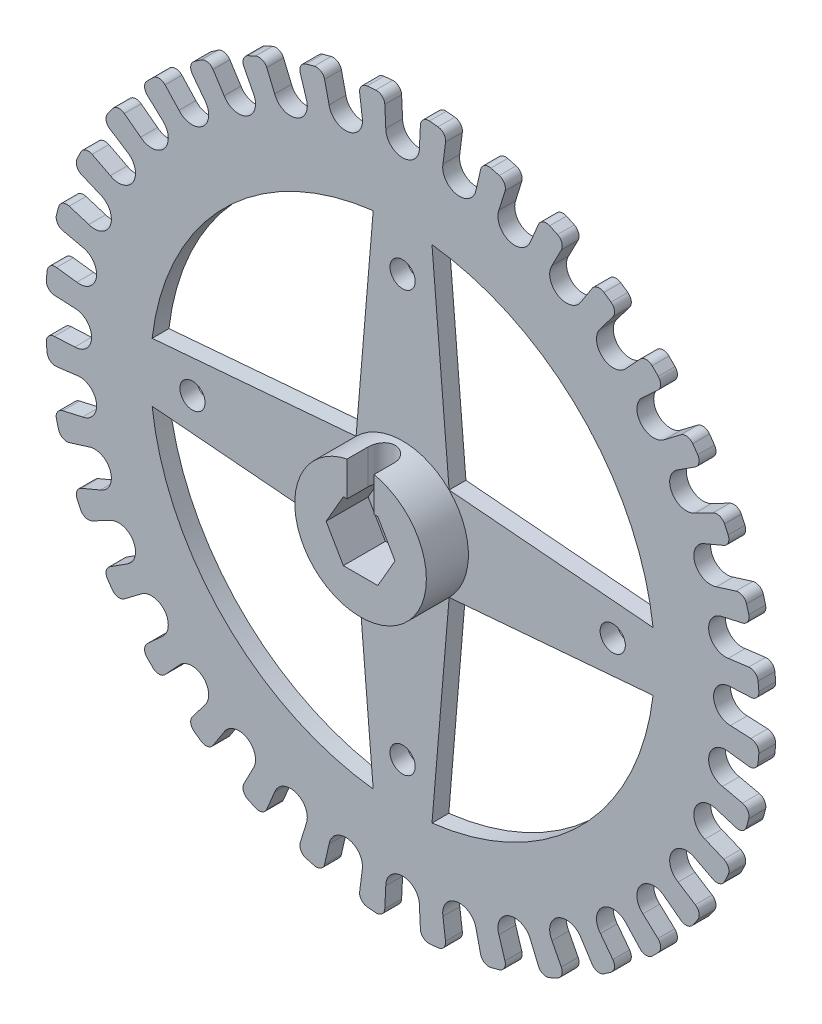
from build123d import *

# Parameters (mm, degrees)
SKETCH1_R                = 42.5
SKETCH1_R_2              = 1.5
BOSS_EXTRUDE1_DEPTH      = 2
CUT_EXTRUDE1_DEPTH       = 61.137342808
FILLET1_R                = 1
CIRPATTERN1_COUNT        = 36
FILLET1_OF_CIRPATTERN1_R = 1
SKETCH6_R                = 7.827729387
BOSS_EXTRUDE2_DEPTH      = 5
CUT_EXTRUDE2_DEPTH       = 5
CUT_EXTRUDE3_DEPTH       = 5


with BuildPart() as part:
    # Sketch1 → Boss-Extrude1 (new body)
    with BuildSketch(Plane.XY):
        Circle(SKETCH1_R)
        with Locations((0, 25)):
            Circle(SKETCH1_R_2, mode=Mode.SUBTRACT)
        with Locations((25, 0)):
            Circle(SKETCH1_R_2, mode=Mode.SUBTRACT)
        with Locations((0, -25)):
            Circle(SKETCH1_R_2, mode=Mode.SUBTRACT)
        with Locations((-25, 0)):
            Circle(SKETCH1_R_2, mode=Mode.SUBTRACT)
        with BuildLine():
            Line((-3.497093615, 29.795475097), (-5.535040531, 5.535040531))
            Line((-5.535040531, 5.535040531), (-29.795475097, 3.497093615))
            ThreePointArc((-29.795475097, 3.497093615), (-21.213203436, 21.213203436), (-3.497093615, 29.795475097))
        make_face(mode=Mode.SUBTRACT)
        Polygon((1.558845727, 0), (0.779422863, 1.35), (-0.779422863, 1.35), (-1.558845727, 0), (-0.779422863, -1.35), (0.779422863, -1.35), align=None, mode=Mode.SUBTRACT)
        with BuildLine():
            Line((3.497093615, 29.795475097), (5.535040531, 5.535040531))
            Line((5.535040531, 5.535040531), (29.795475097, 3.497093615))
            ThreePointArc((29.795475097, 3.497093615), (21.213203436, 21.213203436), (3.497093615, 29.795475097))
        make_face(mode=Mode.SUBTRACT)
        with BuildLine():
            Line((29.795475097, -3.497093615), (5.535040531, -5.535040531))
            Line((5.535040531, -5.535040531), (3.497093615, -29.795475097))
            ThreePointArc((3.497093615, -29.795475097), (21.213203436, -21.213203436), (29.795475097, -3.497093615))
        make_face(mode=Mode.SUBTRACT)
        with BuildLine():
            Line((-3.497093615, -29.795475097), (-5.535040531, -5.535040531))
            Line((-5.535040531, -5.535040531), (-29.795475097, -3.497093615))
            ThreePointArc((-29.795475097, -3.497093615), (-21.213203436, -21.213203436), (-3.497093615, -29.795475097))
        make_face(mode=Mode.SUBTRACT)
    extrude(amount=BOSS_EXTRUDE1_DEPTH)

    # Sketch2 → Cut-Extrude1 (cut, through all)
    with BuildSketch(Plane.XY.offset(2)):
        with BuildLine():
            Line((-2, 39), (-2.25, 44.151660968))
            Line((-2.25, 44.151660968), (2.25, 44.151660968))
            Line((2.25, 44.151660968), (2, 39))
            ThreePointArc((2, 39), (0, 37), (-2, 39))
        make_face()
    cut_extrude1 = extrude(amount=-CUT_EXTRUDE1_DEPTH, mode=Mode.SUBTRACT)

    # Fillet1
    fillet1_edges = [part.edges().sort_by_distance(p)[0] for p in [
        (2.167165012, 42.444709868, 1),
        (-2.167165012, 42.444709868, 1),
    ]]
    fillet(fillet1_edges, radius=FILLET1_R)

    # CirPattern1: Cut-Extrude1 ×36 about axis
    cirpattern1_axis = Axis((0, 0, 0), (0, 0, 1))
    for i in range(1, CIRPATTERN1_COUNT):
        add(cut_extrude1.rotate(cirpattern1_axis, i * 360 / CIRPATTERN1_COUNT), mode=Mode.SUBTRACT)

    # Fillet1 of CirPattern1
    fillet1_of_cirpattern1_edges = [part.edges().sort_by_distance(p)[0] for p in [
        (-5.236205614, 42.176203608, 1),
        (-9.504687426, 41.423555098, 1),
        (-12.480476783, 40.626194743, 1),
        (-16.553414722, 39.143766567, 1),
        (-19.34553498, 37.841779508, 1),
        (-23.099174889, 35.674614496, 1),
        (-25.622788885, 33.907560952, 1),
        (-28.943078315, 31.121507317, 1),
        (-31.121507317, 28.943078315, 1),
        (-33.907560952, 25.622788885, 1),
        (-35.674614496, 23.099174889, 1),
        (-37.841779508, 19.34553498, 1),
        (-39.143766567, 16.553414722, 1),
        (-40.626194743, 12.480476783, 1),
        (-41.423555098, 9.504687426, 1),
        (-42.176203608, 5.236205614, 1),
        (-42.444709868, 2.167165012, 1),
        (-42.444709868, -2.167165012, 1),
        (-42.176203608, -5.236205614, 1),
        (-41.423555098, -9.504687426, 1),
        (-40.626194743, -12.480476783, 1),
        (-39.143766567, -16.553414722, 1),
        (-37.841779508, -19.34553498, 1),
        (-35.674614496, -23.099174889, 1),
        (-33.907560952, -25.622788885, 1),
        (-31.121507317, -28.943078315, 1),
        (-28.943078315, -31.121507317, 1),
        (-25.622788885, -33.907560952, 1),
        (-23.099174889, -35.674614496, 1),
        (-19.34553498, -37.841779508, 1),
        (-16.553414722, -39.143766567, 1),
        (-12.480476783, -40.626194743, 1),
        (-9.504687426, -41.423555098, 1),
        (-5.236205614, -42.176203608, 1),
        (-2.167165012, -42.444709868, 1),
        (2.167165012, -42.444709868, 1),
        (5.236205614, -42.176203608, 1),
        (9.504687426, -41.423555098, 1),
        (12.480476783, -40.626194743, 1),
        (16.553414722, -39.143766567, 1),
        (19.34553498, -37.841779508, 1),
        (23.099174889, -35.674614496, 1),
        (25.622788885, -33.907560952, 1),
        (28.943078315, -31.121507317, 1),
        (31.121507317, -28.943078315, 1),
        (33.907560952, -25.622788885, 1),
        (35.674614496, -23.099174889, 1),
        (37.841779508, -19.34553498, 1),
        (39.143766567, -16.553414722, 1),
        (40.626194743, -12.480476783, 1),
        (41.423555098, -9.504687426, 1),
        (42.176203608, -5.236205614, 1),
        (42.444709868, -2.167165012, 1),
        (42.444709868, 2.167165012, 1),
        (42.176203608, 5.236205614, 1),
        (41.423555098, 9.504687426, 1),
        (40.626194743, 12.480476783, 1),
        (39.143766567, 16.553414722, 1),
        (37.841779508, 19.34553498, 1),
        (35.674614496, 23.099174889, 1),
        (33.907560952, 25.622788885, 1),
        (31.121507317, 28.943078315, 1),
        (28.943078315, 31.121507317, 1),
        (25.622788885, 33.907560952, 1),
        (23.099174889, 35.674614496, 1),
        (19.34553498, 37.841779508, 1),
        (16.553414722, 39.143766567, 1),
        (12.480476783, 40.626194743, 1),
        (9.504687426, 41.423555098, 1),
        (5.236205614, 42.176203608, 1),
    ]]
    fillet(fillet1_of_cirpattern1_edges, radius=FILLET1_OF_CIRPATTERN1_R)

    # Sketch6 → Boss-Extrude2 (add)
    with BuildSketch(Plane.XY.offset(2)):
        with Locations(Location((0, 0, 0), (0, 0, 225))):
            Circle(SKETCH6_R)
    extrude(amount=BOSS_EXTRUDE2_DEPTH)

    # Sketch7 → Cut-Extrude2 (cut)
    with BuildSketch(Plane.XY.offset(7)):
        Polygon((4.099186911, 0), (2.049593456, 3.55), (-2.049593456, 3.55), (-4.099186911, 0), (-2.049593456, -3.55), (2.049593456, -3.55), align=None)
    extrude(amount=-CUT_EXTRUDE2_DEPTH, mode=Mode.SUBTRACT)

    # Sketch8 → Cut-Extrude3 (cut)
    with BuildSketch(Plane.XZ.offset(-3.55)):
        with BuildLine():
            Line((1.6, 4.5), (1.6, 7.951889224))
            Line((1.6, 7.951889224), (-1.6, 7.951889224))
            Line((-1.6, 7.951889224), (-1.6, 4.5))
            ThreePointArc((-1.6, 4.5), (0, 2.9), (1.6, 4.5))
        make_face()
    extrude(amount=-CUT_EXTRUDE3_DEPTH, mode=Mode.SUBTRACT)


solid = part.part
